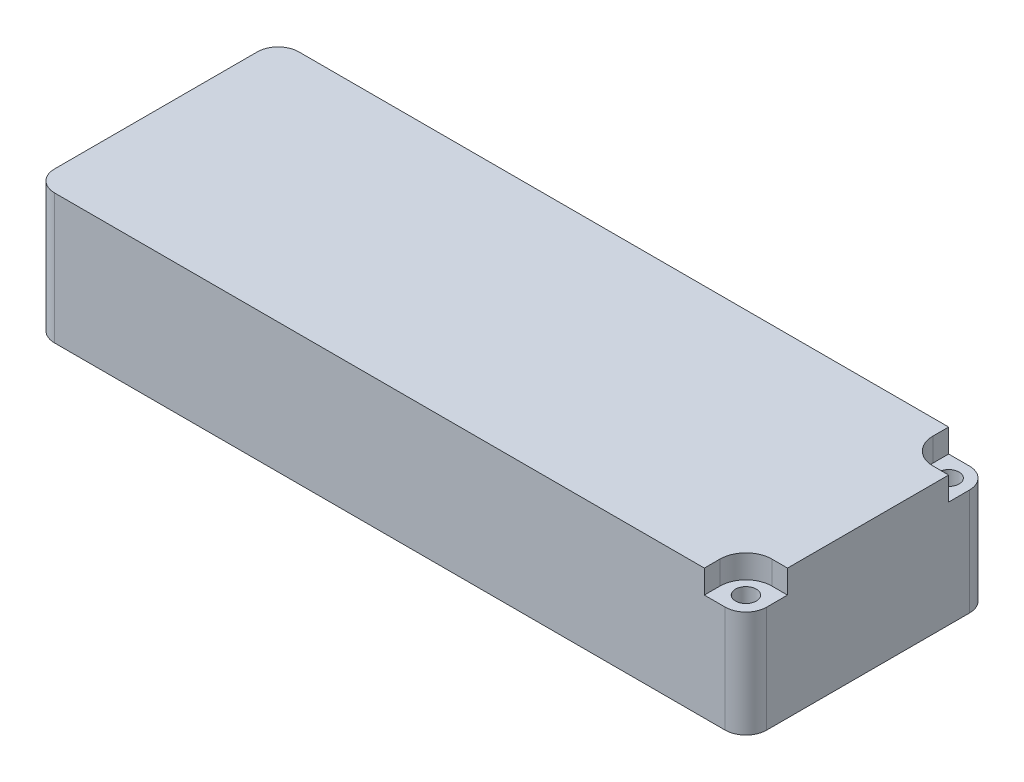
from build123d import *

# Parameters (mm, degrees)
SKETCH1_W           = 137
SKETCH1_H           = 47
BOSS_EXTRUDE1_DEPTH = 25
FILLET1_R           = 4
SKETCH2_W           = 8
SKETCH2_H           = 8
CUT_EXTRUDE1_DEPTH  = 4.5
FILLET2_R           = 5
SKETCH3_R           = 2
CUT_EXTRUDE2_DEPTH  = 10


with BuildPart() as part:
    # Sketch1 → Boss-Extrude1 (new body)
    with BuildSketch(Plane(origin=(0, 0, 0), x_dir=(1, 0, 0), z_dir=(0, 1, 0))):
        Rectangle(SKETCH1_W, SKETCH1_H)
    extrude(amount=BOSS_EXTRUDE1_DEPTH)

    # Fillet1
    fillet1_edges = [part.edges().sort_by_distance(p)[0] for p in [
        (-68.5, 12.5, 23.5),
        (68.5, 12.5, 23.5),
        (68.5, 12.5, -23.5),
        (-68.5, 12.5, -23.5),
    ]]
    fillet(fillet1_edges, radius=FILLET1_R)

    # Sketch2 → Cut-Extrude1 (cut)
    with BuildSketch(Plane(origin=(0, 25, 0), x_dir=(1, 0, 0), z_dir=(0, 1, 0))):
        with Locations((64.5, 19.5)):
            Rectangle(SKETCH2_W, SKETCH2_H)
        with Locations((64.5, -19.5)):
            Rectangle(SKETCH2_W, SKETCH2_H)
    extrude(amount=-CUT_EXTRUDE1_DEPTH, mode=Mode.SUBTRACT)

    # Fillet2
    fillet2_edges = [part.edges().sort_by_distance(p)[0] for p in [
        (60.5, 22.75, -15.5),
        (60.5, 22.75, 15.5),
    ]]
    fillet(fillet2_edges, radius=FILLET2_R)

    # Sketch3 → Cut-Extrude2 (cut)
    with BuildSketch(Plane(origin=(0, 20.5, 0), x_dir=(1, 0, 0), z_dir=(0, 1, 0))):
        with Locations(Location((64.5, 19.5, 0), (0, 0, 270))):
            Circle(SKETCH3_R)
        with Locations(Location((64.5, -19.5, 0), (0, 0, 90))):
            Circle(SKETCH3_R)
    extrude(amount=-CUT_EXTRUDE2_DEPTH, mode=Mode.SUBTRACT)


solid = part.part
